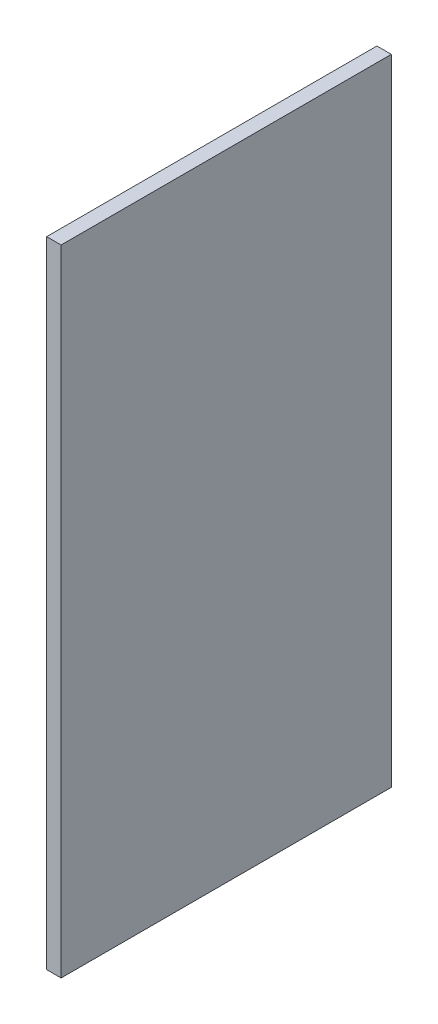
from build123d import *

# Parameters (mm, degrees)
SKETCH1_W           = 412
SKETCH1_H           = 792
BOSS_EXTRUDE1_DEPTH = 18


with BuildPart() as part:
    # Sketch1 → Boss-Extrude1 (new body)
    with BuildSketch(Plane(origin=(0, 0, 0), x_dir=(0, 0, -1), z_dir=(1, 0, 0))):
        with Locations((206, 396)):
            Rectangle(SKETCH1_W, SKETCH1_H)
    extrude(amount=BOSS_EXTRUDE1_DEPTH)


solid = part.part
